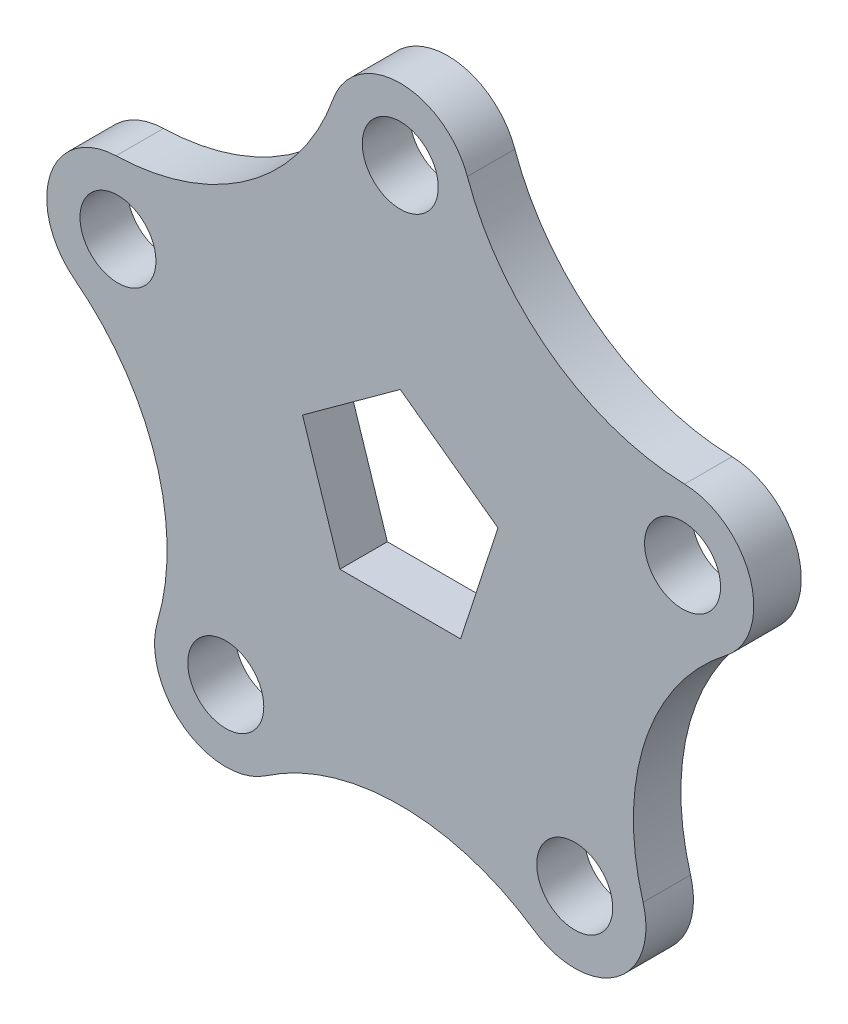
from build123d import *

# Parameters (mm, degrees)
SKETCH1_R           = 8
BOSS_EXTRUDE1_DEPTH = 10


with BuildPart() as part:
    # Sketch1 → Boss-Extrude1 (new body)
    with BuildSketch(Plane.XY):
        with BuildLine():
            ThreePointArc((14.132148934, 67.528157367), (0, 77.5), (-14.132148934, 67.528157367))
            ThreePointArc((-14.132148934, 67.528157367), (-31.850049433, 43.837832205), (-59.85601991, 34.307820558))
            ThreePointArc((-59.85601991, 34.307820558), (-73.706880013, 23.948817064), (-68.590168285, 7.426875892))
            ThreePointArc((-68.590168285, 7.426875892), (-51.534462525, -16.744561909), (-51.125203669, -46.324758182))
            ThreePointArc((-51.125203669, -46.324758182), (-45.553357053, -62.698817064), (-28.25890636, -62.938095635))
            ThreePointArc((-28.25890636, -62.938095635), (0, -54.186540592), (28.25890636, -62.938095635))
            ThreePointArc((28.25890636, -62.938095635), (45.553357053, -62.698817064), (51.125203669, -46.324758182))
            ThreePointArc((51.125203669, -46.324758182), (51.534462525, -16.744561909), (68.590168285, 7.426875892))
            ThreePointArc((68.590168285, 7.426875892), (73.706880013, 23.948817064), (59.85601991, 34.307820558))
            ThreePointArc((59.85601991, 34.307820558), (31.850049433, 43.837832205), (14.132148934, 67.528157367))
        make_face()
        with Locations((0, 62.5)):
            Circle(SKETCH1_R, mode=Mode.SUBTRACT)
        with Locations((59.441032268, 19.313562148)):
            Circle(SKETCH1_R, mode=Mode.SUBTRACT)
        with Locations((36.736578268, -50.563562148)):
            Circle(SKETCH1_R, mode=Mode.SUBTRACT)
        with Locations((-36.736578268, -50.563562148)):
            Circle(SKETCH1_R, mode=Mode.SUBTRACT)
        with Locations((-59.441032268, 19.313562148)):
            Circle(SKETCH1_R, mode=Mode.SUBTRACT)
        Polygon((20.57248383, 6.684405197), (0, 21.631189606), (-20.57248383, 6.684405197), (-12.71449424, -17.5), (12.71449424, -17.5), align=None, mode=Mode.SUBTRACT)
    extrude(amount=BOSS_EXTRUDE1_DEPTH)


solid = part.part
